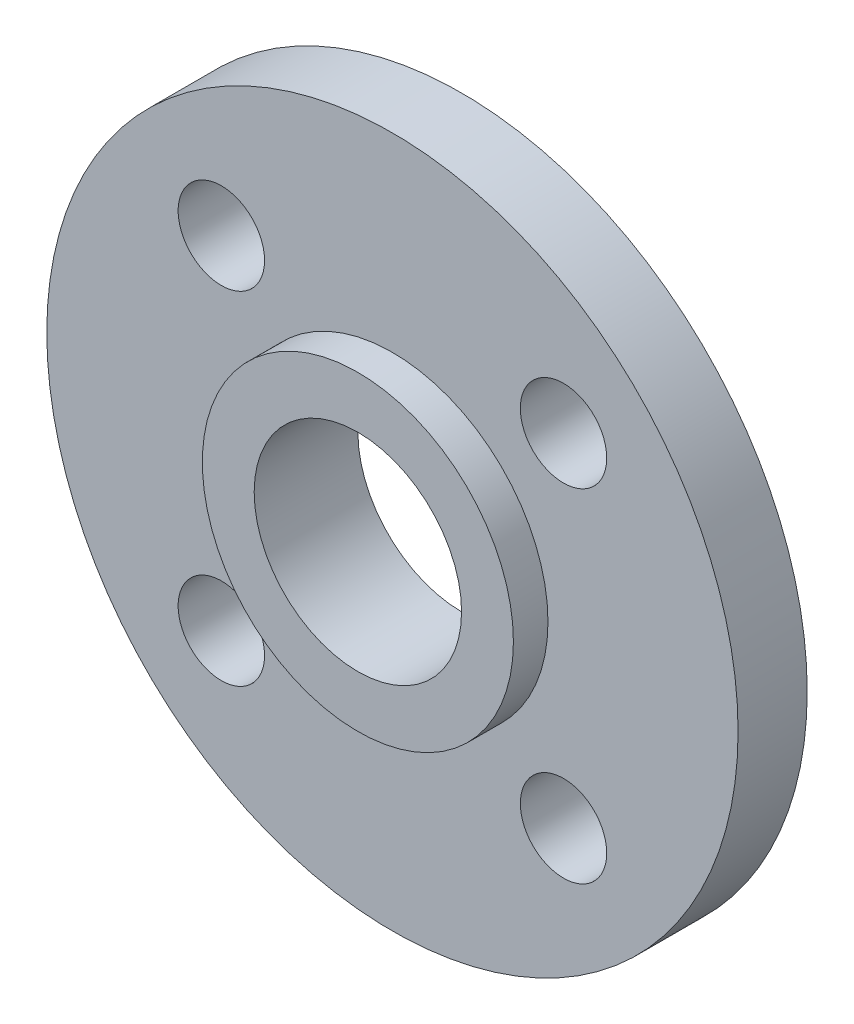
from build123d import *

# Parameters (mm, degrees)
SKETCH_1_R      = 10
SKETCH_1_R_2    = 1.25
SKETCH_1_R_3    = 3
EXTRUDE_1_DEPTH = 2
SKETCH_2_R      = 4.5
SKETCH_2_R_2    = 3
EXTRUDE_2_DEPTH = 1


with BuildPart() as part:
    # 草图1 → 凸台-拉伸1 (new body)
    with BuildSketch(Plane.XY):
        Circle(SKETCH_1_R)
        with Locations((-4.949747468, 4.949747468)):
            Circle(SKETCH_1_R_2, mode=Mode.SUBTRACT)
        with Locations((4.949747468, 4.949747468)):
            Circle(SKETCH_1_R_2, mode=Mode.SUBTRACT)
        with Locations((4.949747468, -4.949747468)):
            Circle(SKETCH_1_R_2, mode=Mode.SUBTRACT)
        with Locations((-4.949747468, -4.949747468)):
            Circle(SKETCH_1_R_2, mode=Mode.SUBTRACT)
        Circle(SKETCH_1_R_3, mode=Mode.SUBTRACT)
    extrude(amount=EXTRUDE_1_DEPTH)

    # 草图2 → 凸台-拉伸2 (add)
    with BuildSketch(Plane.XY.offset(2)):
        Circle(SKETCH_2_R)
        Circle(SKETCH_2_R_2, mode=Mode.SUBTRACT)
    extrude(amount=EXTRUDE_2_DEPTH)


solid = part.part
